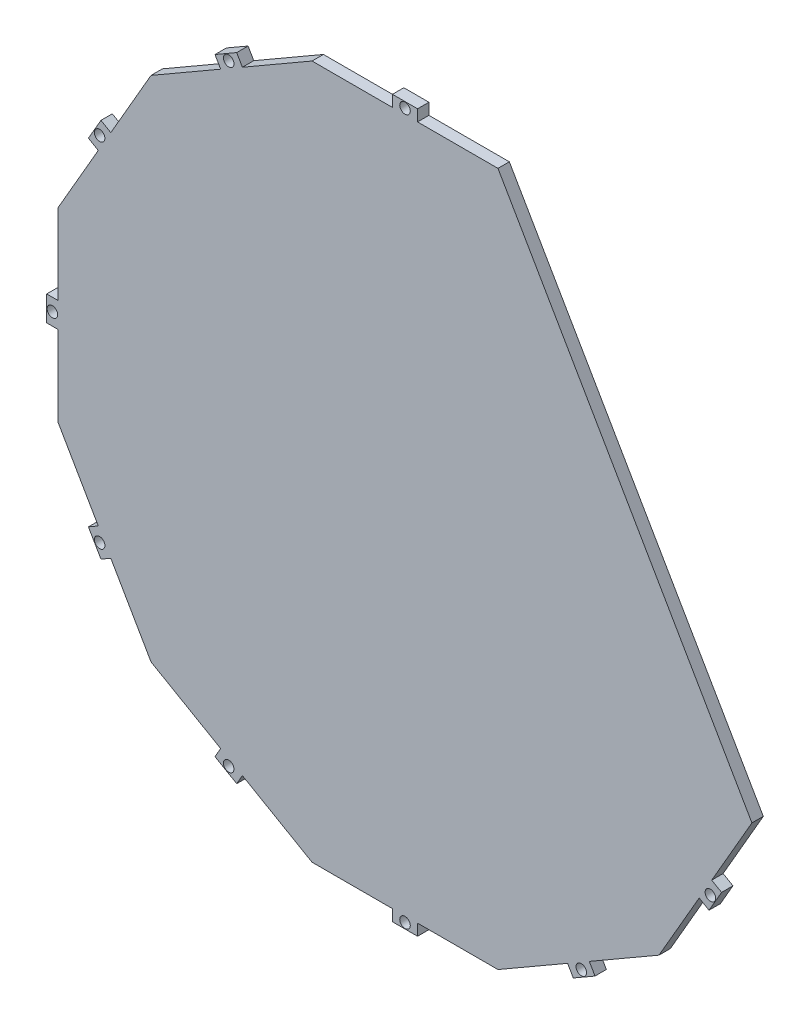
from build123d import *

# Parameters (mm, degrees)
BOSS_EXTRUDE1_DEPTH = 3.175
SKETCH3_R           = 1.47
CUT_EXTRUDE5_DEPTH  = 10
CUT_EXTRUDE6_DEPTH  = 10


with BuildPart() as part:
    # Sketch1 → Boss-Extrude1 (new body)
    with BuildSketch(Plane.XY):
        Polygon((-26.794919243, 100), (26.794919243, 100), (73.205080757, 73.205080757), (100, 26.794919243), (100, -26.794919243), (73.205080757, -73.205080757), (26.794919243, -100), (-26.794919243, -100), (-73.205080757, -73.205080757), (-100, -26.794919243), (-100, 26.794919243), (-73.205080757, 73.205080757), align=None)
    extrude(amount=BOSS_EXTRUDE1_DEPTH)

    # Sketch3 → Cut-Extrude5 (cut)
    with BuildSketch(Plane(origin=(0, 0, 0), x_dir=(-1, 0, 0), z_dir=(0, 0, -1))):
        Polygon((51.443588913, -82.102909721), (53.031088913, -84.852540378), (73.205080757, -73.205080757), (84.852540378, -53.031088913), (82.102909721, -51.443588913), (70.880819443, -70.880819443), align=None)
        Polygon((-26.794919243, -100), (-3.5, -100), (-3.5, -96.825), (-25.944180557, -96.825), (-45.381411087, -85.602909721), (-46.968911087, -88.352540378), align=None)
        Polygon((-73.205080757, -73.205080757), (-53.031088913, -84.852540378), (-51.443588913, -82.102909721), (-70.880819443, -70.880819443), (-82.102909721, -51.443588913), (-84.852540378, -53.031088913), align=None)
        with Locations((-49.20625, -85.22772505)):
            Circle(SKETCH3_R)
        Polygon((-100, -26.794919243), (-88.352540378, -46.968911087), (-85.602909721, -45.381411087), (-96.825, -25.944180557), (-96.825, -3.5), (-100, -3.5), align=None)
        Polygon((-100, 26.794919243), (-100, 3.5), (-96.825, 3.5), (-96.825, 25.944180557), (-85.602909721, 45.381411087), (-88.352540378, 46.968911087), align=None)
        Polygon((-26.794919243, 100), (-46.968911087, 88.352540378), (-45.381411087, 85.602909721), (-25.944180557, 96.825), (-3.5, 96.825), (-3.5, 100), align=None)
        Polygon((26.794919243, 100), (3.5, 100), (3.5, 96.825), (25.944180557, 96.825), (45.381411087, 85.602909721), (46.968911087, 88.352540378), align=None)
        Polygon((73.205080757, 73.205080757), (53.031088913, 84.852540378), (51.443588913, 82.102909721), (70.880819443, 70.880819443), (82.102909721, 51.443588913), (84.852540378, 53.031088913), align=None)
        with Locations((-85.22772505, 49.20625)):
            Circle(SKETCH3_R)
        with Locations((-49.20625, 85.22772505)):
            Circle(SKETCH3_R)
        with Locations((0, 98.4125)):
            Circle(SKETCH3_R)
        with Locations((49.20625, 85.22772505)):
            Circle(SKETCH3_R)
        with Locations((85.22772505, 49.20625)):
            Circle(SKETCH3_R)
        with Locations((98.4125, 0)):
            Circle(SKETCH3_R)
        Polygon((96.825, -3.5), (96.825, -25.944180557), (85.602909721, -45.381411087), (88.352540378, -46.968911087), (100, -26.794919243), (100, -3.5), align=None)
        with Locations((85.22772505, -49.20625)):
            Circle(SKETCH3_R)
        Polygon((45.381411087, -85.602909721), (25.944180557, -96.825), (3.5, -96.825), (3.5, -100), (26.794919243, -100), (46.968911087, -88.352540378), align=None)
        with Locations((0, -98.4125)):
            Circle(SKETCH3_R)
        with Locations((49.20625, -85.22772505)):
            Circle(SKETCH3_R)
        with Locations((-85.22772505, -49.20625)):
            Circle(SKETCH3_R)
        with Locations((-98.4125, 0)):
            Circle(SKETCH3_R)
        Polygon((-82.102909721, 51.443588913), (-70.880819443, 70.880819443), (-51.443588913, 82.102909721), (-53.031088913, 84.852540378), (-73.205080757, 73.205080757), (-84.852540378, 53.031088913), align=None)
        Polygon((100, 26.794919243), (88.352540378, 46.968911087), (85.602909721, 45.381411087), (96.825, 25.944180557), (96.825, 3.5), (100, 3.5), align=None)
    extrude(amount=-CUT_EXTRUDE5_DEPTH, mode=Mode.SUBTRACT)

    # Sketch4 → Cut-Extrude6 (cut)
    with BuildSketch(Plane.XY.offset(3.175)):
        Polygon((27.531680557, 99.574630657), (25.944180557, 96.825), (96.825, -25.944180557), (101.705845195, -25.944180557), (99.574630657, 27.531680557), (73.205080757, 73.205080757), align=None)
    extrude(amount=-CUT_EXTRUDE6_DEPTH, mode=Mode.SUBTRACT)


solid = part.part
